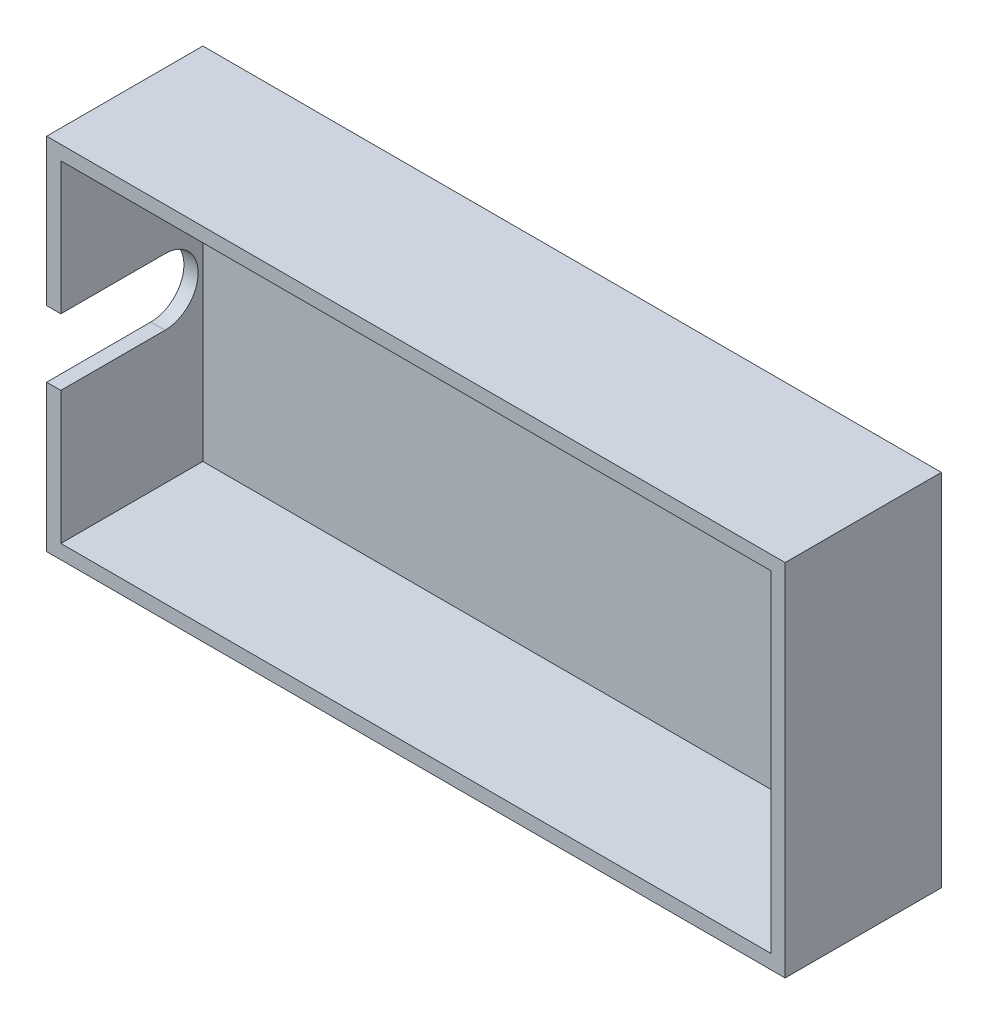
from build123d import *

# Parameters (mm, degrees)
ESQUISSE1_W             = 75
ESQUISSE1_H             = 35
BOSS_EXTRU_1_DEPTH      = 15
COQUE1_T                = 1.5
ENL_V_MAT_EXTRU_1_DEPTH = 15


with BuildPart() as part:
    # Esquisse1 → Boss.-Extru.1 (new body)
    with BuildSketch(Plane.XY):
        with Locations((37.5, 17.5)):
            Rectangle(ESQUISSE1_W, ESQUISSE1_H)
    extrude(amount=BOSS_EXTRU_1_DEPTH)

    # Coque1
    coque1_openings = [part.faces().sort_by_distance(p)[0] for p in [
        (37.5, 17.5, 15),
    ]]
    offset(amount=COQUE1_T, openings=coque1_openings, kind=Kind.INTERSECTION)

    # Esquisse2 → Enlèv. mat.-Extru.1 (cut)
    with BuildSketch(Plane.ZY.offset(1.5)):
        with BuildLine():
            Line((4, 21), (15.502923277, 21))
            ThreePointArc((15.502923277, 21), (19.002923277, 17.5), (15.502923277, 14))
            Line((15.502923277, 14), (4, 14))
            ThreePointArc((4, 14), (0.5, 17.5), (4, 21))
        make_face()
    extrude(amount=-ENL_V_MAT_EXTRU_1_DEPTH, mode=Mode.SUBTRACT)


solid = part.part
